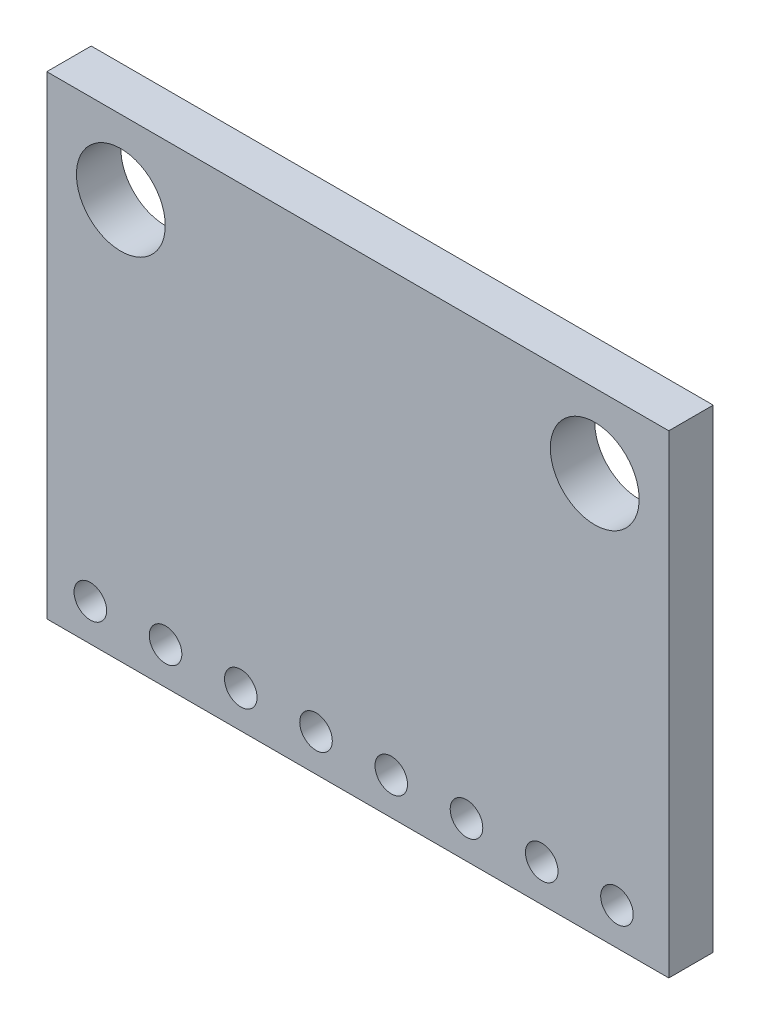
from build123d import *

# Parameters (mm, degrees)
CROQUIS1_W              = 21
CROQUIS1_H              = 16
CROQUIS1_R              = 1.5
SALIENTE_EXTRUIR1_DEPTH = 1.5
CROQUIS2_R              = 0.55
CORTAR_EXTRUIR1_DEPTH   = 1.5


with BuildPart() as part:
    # Croquis1 → Saliente-Extruir1 (new body)
    with BuildSketch(Plane.XY):
        Rectangle(CROQUIS1_W, CROQUIS1_H)
        with Locations((-8, 5.5)):
            Circle(CROQUIS1_R, mode=Mode.SUBTRACT)
        with Locations(Location((8, 5.5, 0), (0, 0, 180))):
            Circle(CROQUIS1_R, mode=Mode.SUBTRACT)
    extrude(amount=SALIENTE_EXTRUIR1_DEPTH)

    # Croquis2 → Cortar-Extruir1 (cut)
    with BuildSketch(Plane(origin=(0, 0, 0), x_dir=(-1, 0, 0), z_dir=(0, 0, -1))):
        with Locations((-8.75, -6.75)):
            Circle(CROQUIS2_R)
        with Locations((-6.21, -6.75)):
            Circle(CROQUIS2_R)
        with Locations((-3.67, -6.75)):
            Circle(CROQUIS2_R)
        with Locations((-1.13, -6.75)):
            Circle(CROQUIS2_R)
        with Locations((1.41, -6.75)):
            Circle(CROQUIS2_R)
        with Locations((3.95, -6.75)):
            Circle(CROQUIS2_R)
        with Locations((6.49, -6.75)):
            Circle(CROQUIS2_R)
        with Locations((9.03, -6.75)):
            Circle(CROQUIS2_R)
    extrude(amount=-CORTAR_EXTRUIR1_DEPTH, mode=Mode.SUBTRACT)


solid = part.part
